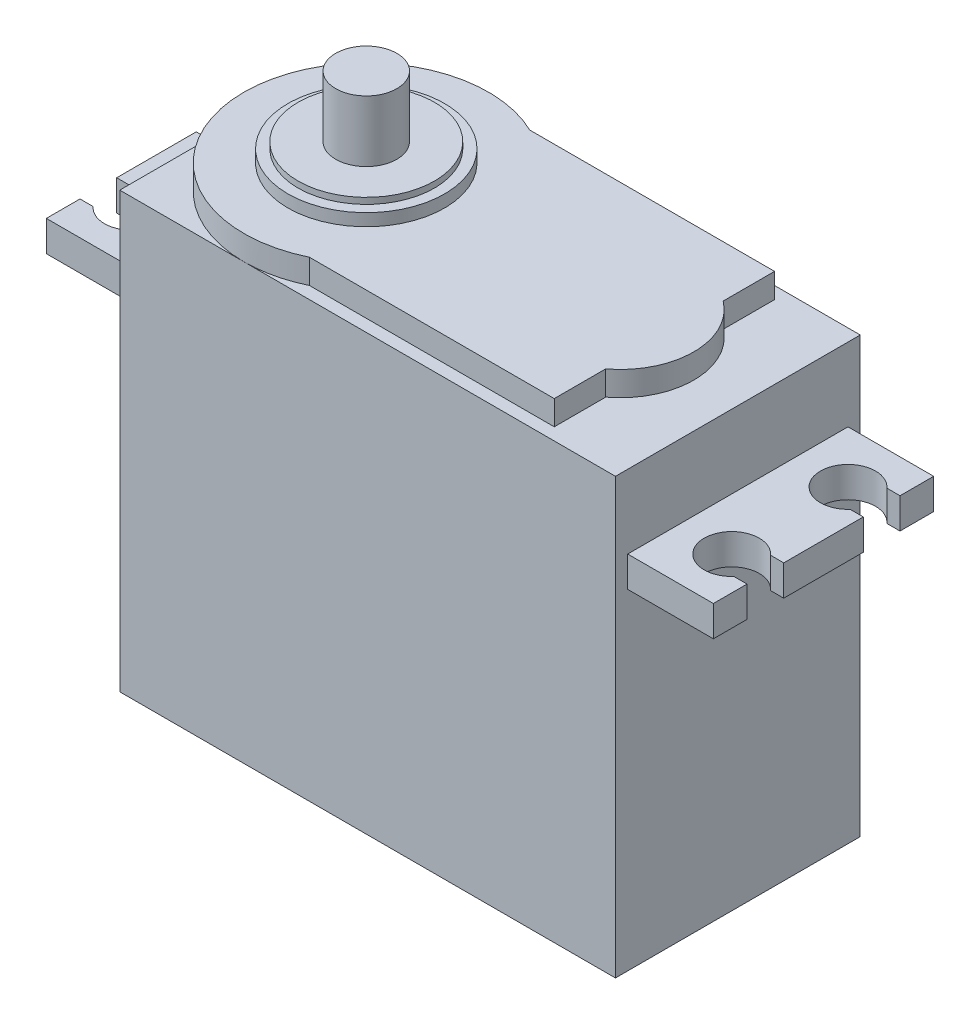
from build123d import *

# Parameters (mm, degrees)
SKETCH1_W            = 40.5
SKETCH1_H            = 20
BOSS_EXTRUDE1_DEPTH  = 35.5
BOSS_EXTRUDE2_DEPTH  = 2
SKETCH3_R            = 6.4
BOSS_EXTRUDE3_DEPTH  = 1
SKETCH4_R            = 5.575
BOSS_EXTRUDE4_DEPTH  = 0.5
BOSS_EXTRUDE5_DEPTH  = 2.5
MIRROR2_COPY_1_DEPTH = 2.5
SKETCH6_R            = 2.5
BOSS_EXTRUDE6_DEPTH  = 5


with BuildPart() as part:
    # Sketch1 → Boss-Extrude1 (new body)
    with BuildSketch(Plane(origin=(0, 0, 0), x_dir=(1, 0, 0), z_dir=(0, 1, 0))):
        Rectangle(SKETCH1_W, SKETCH1_H)
    extrude(amount=BOSS_EXTRUDE1_DEPTH)

    # Sketch2 → Boss-Extrude2 (add)
    with BuildSketch(Plane(origin=(0, 35.5, 0), x_dir=(1, 0, 0), z_dir=(0, 1, 0))):
        with BuildLine():
            Line((-5.75, -9), (14.25, -9))
            Line((14.25, -9), (14.25, -4.8))
            ThreePointArc((14.25, -4.8), (16.65, 0), (14.25, 4.8))
            Line((14.25, 4.8), (14.25, 9))
            Line((14.25, 9), (-5.75, 9))
            ThreePointArc((-5.75, 9), (-20.108898944, 0), (-5.75, -9))
        make_face()
    extrude(amount=BOSS_EXTRUDE2_DEPTH)

    # Sketch3 → Boss-Extrude3 (add)
    with BuildSketch(Plane(origin=(0, 37.5, 0), x_dir=(1, 0, 0), z_dir=(0, 1, 0))):
        with Locations(Location((-10.108898944, 0, 0), (0, 0, 270))):
            Circle(SKETCH3_R)
    extrude(amount=BOSS_EXTRUDE3_DEPTH)

    # Sketch4 → Boss-Extrude4 (add)
    with BuildSketch(Plane(origin=(0, 38.5, 0), x_dir=(1, 0, 0), z_dir=(0, 1, 0))):
        with Locations(Location((-10.108898944, 0, 0), (0, 0, 270))):
            Circle(SKETCH4_R)
    extrude(amount=BOSS_EXTRUDE4_DEPTH)

    # Sketch5 → Boss-Extrude5 (add)
    with BuildSketch(Plane(origin=(0, 29.5, 0), x_dir=(1, 0, 0), z_dir=(0, 1, 0))):
        with BuildLine():
            Line((20.25, 9), (27.25, 9))
            Line((27.25, 9), (27.25, 6.25))
            Line((27.25, 6.25), (26.177050983, 6.25))
            ThreePointArc((26.177050983, 6.25), (22.25, 4.75), (26.177050983, 3.25))
            Line((26.177050983, 3.25), (27.25, 3.25))
            Line((27.25, 3.25), (27.25, 0))
            Line((27.25, 0), (20.25, 0))
            Line((20.25, 0), (20.25, 9))
        make_face()
    boss_extrude5 = extrude(amount=-BOSS_EXTRUDE5_DEPTH)

    # Mirror1: Boss-Extrude5 across plane
    add(boss_extrude5.mirror(Plane(origin=(0, 0, 0), x_dir=(0, 0, 1), z_dir=(1, 0, 0))))

    # Mirror2: Boss-Extrude5 across plane
    add(boss_extrude5.mirror(Plane.XY))

    # Mirror2 copy 1 sketch → Mirror2 copy 1 (add)
    with BuildSketch(Plane(origin=(0, 29.5, 0), x_dir=(-1, 0, 0), z_dir=(0, 1, 0))):
        with BuildLine():
            Line((20.25, 9), (27.25, 9))
            Line((27.25, 9), (27.25, 6.25))
            Line((27.25, 6.25), (26.177050983, 6.25))
            ThreePointArc((26.177050983, 6.25), (22.25, 4.75), (26.177050983, 3.25))
            Line((26.177050983, 3.25), (27.25, 3.25))
            Line((27.25, 3.25), (27.25, 0))
            Line((27.25, 0), (20.25, 0))
            Line((20.25, 0), (20.25, 9))
        make_face()
    extrude(amount=-MIRROR2_COPY_1_DEPTH)

    # Sketch6 → Boss-Extrude6 (add)
    with BuildSketch(Plane(origin=(0, 39, 0), x_dir=(1, 0, 0), z_dir=(0, 1, 0))):
        with Locations(Location((-10.108898944, 0, 0), (0, 0, 270))):
            Circle(SKETCH6_R)
    extrude(amount=BOSS_EXTRUDE6_DEPTH)


solid = part.part
